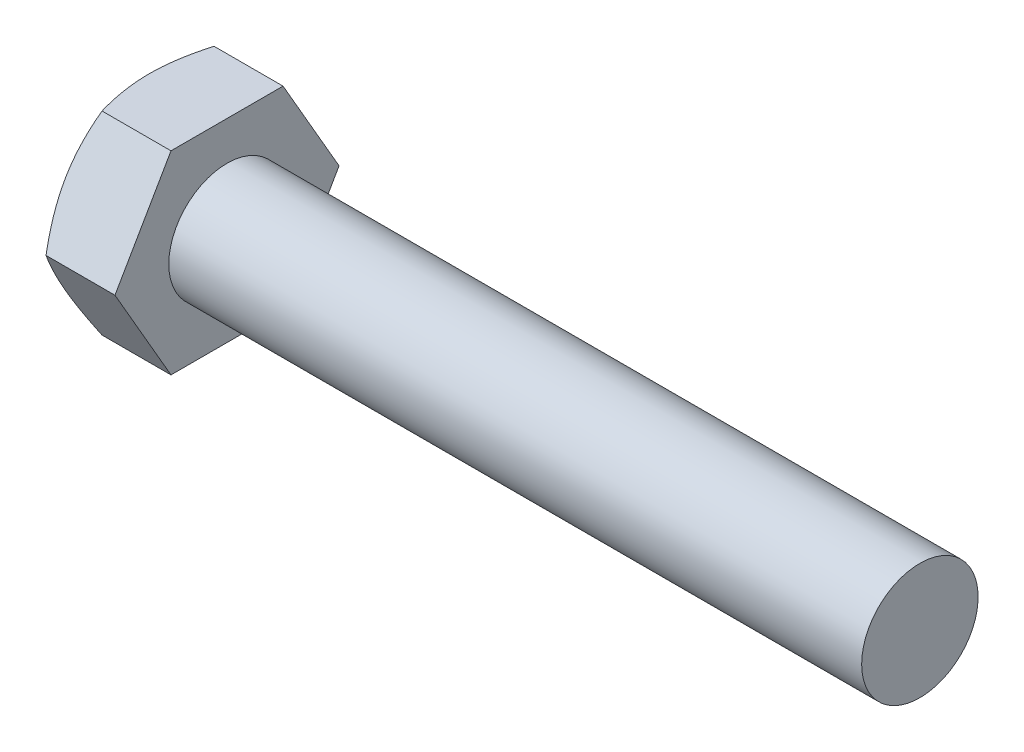
from build123d import *

# Parameters (mm, degrees)
SKETCH2_R           = 3
BOSS_EXTRUDE1_DEPTH = 35.7
BOSS_EXTRUDE2_DEPTH = 4


with BuildPart() as part:
    # Sketch2 → Boss-Extrude1 (new body)
    with BuildSketch(Plane(origin=(0, 0, 0), x_dir=(0, 0, -1), z_dir=(1, 0, 0))):
        with Locations(Location((0, 0, 0), (0, 0, 180))):
            Circle(SKETCH2_R)
    extrude(amount=BOSS_EXTRUDE1_DEPTH)

    # Sketch3 → Boss-Extrude2 (add)
    with BuildSketch(Plane.ZY):
        Polygon((5.773502692, 0), (2.886751346, 5), (-2.886751346, 5), (-5.773502692, 0), (-2.886751346, -5), (2.886751346, -5), align=None)
    extrude(amount=BOSS_EXTRUDE2_DEPTH)

    # Sketch5 → Cut-Revolve1 (revolve, cut)
    with BuildSketch(Plane(origin=(0, 0, 0), x_dir=(1, 0, 0), z_dir=(0, 1, 0))):
        Polygon((-4, 5), (-4, 5.773502692), (-3.553418013, 5.773502692), align=None)
    revolve(axis=Axis((35.7, 0, 0), (-1, 0, 0)), mode=Mode.SUBTRACT)


solid = part.part
